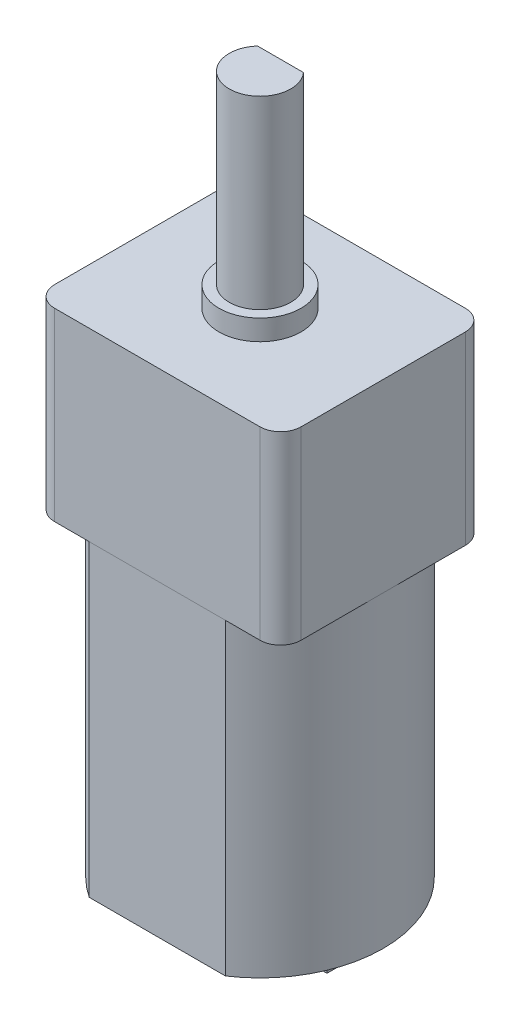
from build123d import *

# Parameters (mm, degrees)
BOSS_EXTRUDE1_DEPTH = 15
SKETCH2_R           = 2.5
SKETCH2_W           = 0.189248461
SKETCH2_H           = 1.830812042
BOSS_EXTRUDE2_DEPTH = 1.5
BOSS_EXTRUDE3_DEPTH = 9
SKETCH4_R           = 2
BOSS_EXTRUDE4_DEPTH = 1
SKETCH5_R           = 1.5
BOSS_EXTRUDE5_DEPTH = 10
CUT_EXTRUDE1_DEPTH  = 8.5


with BuildPart() as part:
    # Sketch1 → Boss-Extrude1 (new body)
    with BuildSketch(Plane(origin=(0, 0, 0), x_dir=(1, 0, 0), z_dir=(0, 1, 0))):
        with BuildLine():
            Line((-3.31662479, 5), (3.31662479, 5))
            ThreePointArc((3.31662479, 5), (6, 0), (3.31662479, -5))
            Line((3.31662479, -5), (-3.31662479, -5))
            ThreePointArc((-3.31662479, -5), (-6, 0), (-3.31662479, 5))
        make_face()
    extrude(amount=BOSS_EXTRUDE1_DEPTH)

    # Sketch2 → Boss-Extrude2 (add)
    with BuildSketch(Plane(origin=(0, 0, 0), x_dir=(-1, 0, 0), z_dir=(0, -1, 0))):
        with Locations(Location((0, 0, 0), (0, 0, 270))):
            Circle(SKETCH2_R)
        with Locations((4.082359667, 0)):
            Rectangle(SKETCH2_W, SKETCH2_H)
        with Locations((-4.082359667, 0)):
            Rectangle(SKETCH2_W, SKETCH2_H)
    extrude(amount=BOSS_EXTRUDE2_DEPTH)


with BuildPart() as body_2:
    # Sketch3 → Boss-Extrude3 (new body)
    with BuildSketch(Plane(origin=(0, 15, 0), x_dir=(1, 0, 0), z_dir=(0, 1, 0))):
        with BuildLine():
            Line((5, 5), (-5, 5))
            ThreePointArc((-5, 5), (-5.707106781, 4.707106781), (-6, 4))
            Line((-6, 4), (-6, -4))
            ThreePointArc((-6, -4), (-5.707106781, -4.707106781), (-5, -5))
            Line((-5, -5), (5, -5))
            ThreePointArc((5, -5), (5.707106781, -4.707106781), (6, -4))
            Line((6, -4), (6, 4))
            ThreePointArc((6, 4), (5.707106781, 4.707106781), (5, 5))
        make_face()
    extrude(amount=BOSS_EXTRUDE3_DEPTH)

    # Sketch4 → Boss-Extrude4 (add)
    with BuildSketch(Plane(origin=(0, 24, 0), x_dir=(1, 0, 0), z_dir=(0, 1, 0))):
        with Locations(Location((0, 0, 0), (0, 0, 90))):
            Circle(SKETCH4_R)
    extrude(amount=BOSS_EXTRUDE4_DEPTH)

    # Sketch5 → Boss-Extrude5 (add)
    with BuildSketch(Plane(origin=(0, 24, 0), x_dir=(1, 0, 0), z_dir=(0, 1, 0))):
        with Locations(Location((0, 0, 0), (0, 0, 270))):
            Circle(SKETCH5_R)
    extrude(amount=BOSS_EXTRUDE5_DEPTH)

    # Sketch6 → Cut-Extrude1 (cut)
    with BuildSketch(Plane(origin=(0, 34, 0), x_dir=(1, 0, 0), z_dir=(0, 1, 0))):
        with BuildLine():
            Line((-1.118033989, 1), (1.118033989, 1))
            ThreePointArc((1.118033989, 1), (0, 1.5), (-1.118033989, 1))
        make_face()
    extrude(amount=-CUT_EXTRUDE1_DEPTH, mode=Mode.SUBTRACT)


solid = Compound([part.part, body_2.part])
